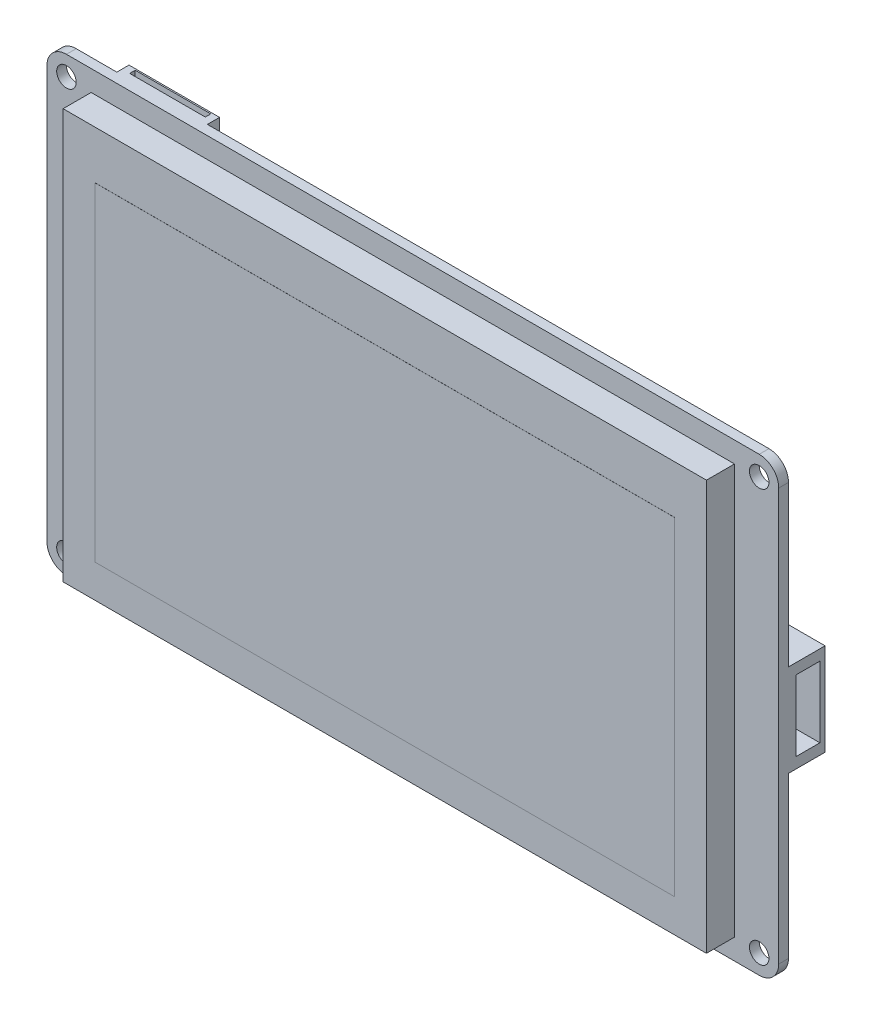
from build123d import *

# Parameters (mm, degrees)
F_120_X_74_PCB_OUTLINE_DEPTH               = 1.6
F_4_START                                  = -0.1
F_4_X_D3_2_PITCH_113_6_X_67_6_PROFILE_R    = 1.6
F_4_X_D3_2_PITCH_113_6_X_67_6_DEPTH        = 1.8
F_105_50_START                             = 1.55
F_105_50_X_67_20_LCD_MODULE_PROFILE_W      = 105.5
F_105_50_X_67_20_LCD_MODULE_PROFILE_H      = 67.2
F_105_50_X_67_20_LCD_MODULE_DEPTH          = 3.45
TOUCH_START                                = 4.98
TOUCH_PANEL_BLACK_BORDER_PROFILE_W         = 105.5
TOUCH_PANEL_BLACK_BORDER_PROFILE_H         = 67.2
TOUCH_PANEL_BLACK_BORDER_DEPTH             = 1.22
VISIBLE_START                              = 6.17
VISIBLE_480_X_272_DISPLAY_AREA_PROFILE_W   = 95.04
VISIBLE_480_X_272_DISPLAY_AREA_PROFILE_H   = 53.86
VISIBLE_480_X_272_DISPLAY_AREA_DEPTH       = 0.045
REAR_START                                 = -6
REAR_4_PIN_UART_CONNECTOR_HOUSING_PROFIL_W = 7.81
REAR_4_PIN_UART_CONNECTOR_HOUSING_PROFIL_H = 15.12
REAR_4_PIN_UART_CONNECTOR_HOUSING_DEPTH    = 6.05
UART_START                                 = -5.15
UART_CONNECTOR_SOCKET_PROFILE_W            = 5.9
UART_CONNECTOR_SOCKET_PROFILE_H            = 11.6
UART_CONNECTOR_SOCKET_DEPTH                = 3.9
REAR_START_2                               = -2
REAR_CARD_HOLDER_PROFILE_W                 = 14.85
REAR_CARD_HOLDER_PROFILE_H                 = 15
REAR_CARD_HOLDER_DEPTH                     = 2.05
CARD_START                                 = -1.77
CARD_OPENING_PROFILE_W                     = 12.4
CARD_OPENING_PROFILE_H                     = 8.7
CARD_OPENING_DEPTH                         = 0.9


with BuildPart() as part:
    # 120 x 74 PCB outline profile → 120 x 74 PCB outline (new body)
    with BuildSketch(Plane.XY):
        with BuildLine():
            Line((-56.8, -37), (56.8, -37))
            ThreePointArc((56.8, -37), (59.0627417, -36.0627417), (60, -33.8))
            Line((60, -33.8), (60, 33.8))
            ThreePointArc((60, 33.8), (59.0627417, 36.0627417), (56.8, 37))
            Line((56.8, 37), (-56.8, 37))
            ThreePointArc((-56.8, 37), (-59.0627417, 36.0627417), (-60, 33.8))
            Line((-60, 33.8), (-60, -33.8))
            ThreePointArc((-60, -33.8), (-59.0627417, -36.0627417), (-56.8, -37))
        make_face()
    extrude(amount=F_120_X_74_PCB_OUTLINE_DEPTH)

    # 4 x D3.2 - pitch 113.6 x 67.6 profile → 4 x D3.2 - pitch 113.6 x 67.6 (cut)
    with BuildSketch(Plane.XY.offset(F_4_START)):
        with Locations((-56.8, -33.8)):
            Circle(F_4_X_D3_2_PITCH_113_6_X_67_6_PROFILE_R)
        with Locations((-56.8, 33.8)):
            Circle(F_4_X_D3_2_PITCH_113_6_X_67_6_PROFILE_R)
        with Locations((56.8, -33.8)):
            Circle(F_4_X_D3_2_PITCH_113_6_X_67_6_PROFILE_R)
        with Locations((56.8, 33.8)):
            Circle(F_4_X_D3_2_PITCH_113_6_X_67_6_PROFILE_R)
    extrude(amount=F_4_X_D3_2_PITCH_113_6_X_67_6_DEPTH, mode=Mode.SUBTRACT)

    # 105.50 x 67.20 LCD module profile → 105.50 x 67.20 LCD module (add)
    with BuildSketch(Plane.XY.offset(F_105_50_START)):
        Rectangle(F_105_50_X_67_20_LCD_MODULE_PROFILE_W, F_105_50_X_67_20_LCD_MODULE_PROFILE_H)
    extrude(amount=F_105_50_X_67_20_LCD_MODULE_DEPTH)

    # Touch panel - black border profile → Touch panel - black border (add)
    with BuildSketch(Plane.XY.offset(TOUCH_START)):
        Rectangle(TOUCH_PANEL_BLACK_BORDER_PROFILE_W, TOUCH_PANEL_BLACK_BORDER_PROFILE_H)
    extrude(amount=TOUCH_PANEL_BLACK_BORDER_DEPTH)

    # Visible 480 x 272 display area profile → Visible 480 x 272 display area (add)
    with BuildSketch(Plane.XY.offset(VISIBLE_START)):
        with Locations((0, -1.23)):
            Rectangle(VISIBLE_480_X_272_DISPLAY_AREA_PROFILE_W, VISIBLE_480_X_272_DISPLAY_AREA_PROFILE_H)
    extrude(amount=VISIBLE_480_X_272_DISPLAY_AREA_DEPTH)

    # Rear 4-pin UART connector housing profile → Rear 4-pin UART connector housing (add)
    with BuildSketch(Plane.XY.offset(REAR_START)):
        with Locations((56.095, 0.04)):
            Rectangle(REAR_4_PIN_UART_CONNECTOR_HOUSING_PROFIL_W, REAR_4_PIN_UART_CONNECTOR_HOUSING_PROFIL_H)
    extrude(amount=REAR_4_PIN_UART_CONNECTOR_HOUSING_DEPTH)

    # UART connector socket profile → UART connector socket (cut)
    with BuildSketch(Plane.XY.offset(UART_START)):
        with Locations((57.25, 0.05)):
            Rectangle(UART_CONNECTOR_SOCKET_PROFILE_W, UART_CONNECTOR_SOCKET_PROFILE_H)
    extrude(amount=UART_CONNECTOR_SOCKET_DEPTH, mode=Mode.SUBTRACT)

    # Rear card holder profile → Rear card holder (add)
    with BuildSketch(Plane.XY.offset(REAR_START_2)):
        with Locations((-42.715, 29.5)):
            Rectangle(REAR_CARD_HOLDER_PROFILE_W, REAR_CARD_HOLDER_PROFILE_H)
    extrude(amount=REAR_CARD_HOLDER_DEPTH)

    # Card opening profile → Card opening (cut)
    with BuildSketch(Plane.XY.offset(CARD_START)):
        with Locations((-42.7, 32.85)):
            Rectangle(CARD_OPENING_PROFILE_W, CARD_OPENING_PROFILE_H)
    extrude(amount=CARD_OPENING_DEPTH, mode=Mode.SUBTRACT)


solid = part.part
